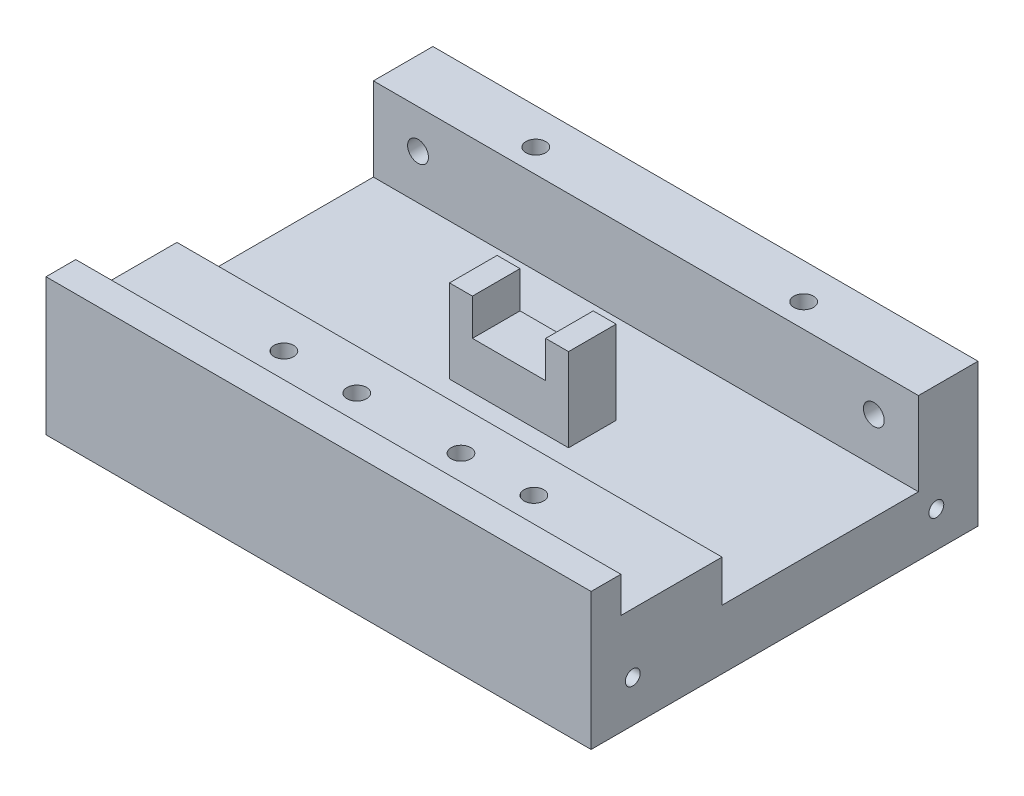
from build123d import *

# Parameters (mm, degrees)
SKETCH1_W                  = 91.58
SKETCH1_H                  = 70.12
SKETCH1_R                  = 1.75
BOSS_EXTRUDE1_DEPTH        = 10
SKETCH2_W                  = 91.58
SKETCH2_H                  = 65
BOSS_EXTRUDE2_DEPTH        = 10
SKETCH3_W                  = 20
SKETCH3_H                  = 8
BOSS_EXTRUDE3_DEPTH        = 14
CUT_EXTRUDE1_DEPTH         = 75
SKETCH6_W                  = 91.58
SKETCH6_H                  = 65
CUT_EXTRUDE3_DEPTH         = 98.319979963
SKETCH11_W                 = 91.58
SKETCH11_H                 = 22
BOSS_EXTRUDE4_DEPTH        = 7
SKETCH12_W                 = 91.58
SKETCH12_H                 = 5
BOSS_EXTRUDE5_DEPTH        = 6
M4_TAPPED_HOLE2_D          = 3.3
M4_TAPPED_HOLE2_DEPTH      = 10
M4_TAPPED_HOLE2_TIP        = 0.991420021
SKETCH16_R                 = 4.25
CUT_EXTRUDE4_DEPTH         = 12
M4_TAPPED_HOLE3_D          = 3.3
SKETCH21_R                 = 3.5
CUT_EXTRUDE5_DEPTH         = 4
M4_TAPPED_HOLE4_D          = 3.3
M4_TAPPED_HOLE4_DEPTH      = 15
M4_TAPPED_HOLE4_TIP        = 0.991420021
M3_TAPPED_HOLE1_AT_2_COUNT = 2
M3_TAPPED_HOLE1_AT_2_PITCH = 51.009802979


with BuildPart() as part:
    # Sketch1 → Boss-Extrude1 (new body)
    with BuildSketch(Plane.XY):
        Rectangle(SKETCH1_W, SKETCH1_H)
        with Locations((-16.825414035, 27.05)):
            Circle(SKETCH1_R, mode=Mode.SUBTRACT)
        with Locations((33.464, 27.56)):
            Circle(SKETCH1_R, mode=Mode.SUBTRACT)
        with Locations((38.29, -27.56)):
            Circle(SKETCH1_R, mode=Mode.SUBTRACT)
        with Locations((-38.29, -27.56)):
            Circle(SKETCH1_R, mode=Mode.SUBTRACT)
    extrude(amount=BOSS_EXTRUDE1_DEPTH)

    # Sketch2 → Boss-Extrude2 (add)
    with BuildSketch(Plane.XZ.offset(35.06)):
        with Locations((0, 32.5)):
            Rectangle(SKETCH2_W, SKETCH2_H)
    extrude(amount=BOSS_EXTRUDE2_DEPTH)

    # Sketch3 → Boss-Extrude3 (add)
    with BuildSketch(Plane(origin=(0, -35.06, 0), x_dir=(1, 0, 0), z_dir=(0, 1, 0))):
        with Locations((0, -29)):
            Rectangle(SKETCH3_W, SKETCH3_H)
    extrude(amount=BOSS_EXTRUDE3_DEPTH)

    # Sketch4 → Cut-Extrude1 (cut)
    with BuildSketch(Plane(origin=(0, 0, 25), x_dir=(-1, 0, 0), z_dir=(0, 0, -1))):
        Polygon((6.15, -21.06), (6.15, -14.91), (-6.15, -14.91), (-6.15, -21.06), (-6.15, -27.21), (6.15, -27.21), align=None)
    extrude(amount=-CUT_EXTRUDE1_DEPTH, mode=Mode.SUBTRACT)

    # Sketch6 → Cut-Extrude3 (cut, through all)
    with BuildSketch(Plane(origin=(0, -21.06, 0), x_dir=(1, 0, 0), z_dir=(0, 1, 0))):
        with Locations((0, -32.5)):
            Rectangle(SKETCH6_W, SKETCH6_H)
    extrude(amount=CUT_EXTRUDE3_DEPTH, mode=Mode.SUBTRACT)

    # Sketch11 → Boss-Extrude4 (add)
    with BuildSketch(Plane(origin=(0, -35.06, 0), x_dir=(1, 0, 0), z_dir=(0, 1, 0))):
        with Locations((0, -54)):
            Rectangle(SKETCH11_W, SKETCH11_H)
    extrude(amount=BOSS_EXTRUDE4_DEPTH)

    # Sketch12 → Boss-Extrude5 (add)
    with BuildSketch(Plane(origin=(0, -28.06, 0), x_dir=(1, 0, 0), z_dir=(0, 1, 0))):
        with Locations((0, -62.5)):
            Rectangle(SKETCH12_W, SKETCH12_H)
    extrude(amount=BOSS_EXTRUDE5_DEPTH)

    # M4 Tapped Hole2
    with Locations(Plane(origin=(0, -28.06, 0), x_dir=(1, 0, 0), z_dir=(0, 1, 0))):
        with Locations((21, -49.825), (-21, -49.825)):
            Hole(M4_TAPPED_HOLE2_D / 2, depth=M4_TAPPED_HOLE2_DEPTH)
            with Locations((0, 0, -(M4_TAPPED_HOLE2_DEPTH + M4_TAPPED_HOLE2_TIP / 2))):  # 118° drill point
                Cone(0, M4_TAPPED_HOLE2_D / 2, M4_TAPPED_HOLE2_TIP, mode=Mode.SUBTRACT)

    # Sketch16 → Cut-Extrude4 (cut)
    with BuildSketch(Plane.XZ.offset(45.06)):
        with Locations(Location((-8.75, 49.825, 0), (0, 0, 270))):
            Circle(SKETCH16_R)
        with Locations(Location((8.75, 49.825, 0), (0, 0, 270))):
            Circle(SKETCH16_R)
    extrude(amount=-CUT_EXTRUDE4_DEPTH, mode=Mode.SUBTRACT)

    # M4 Tapped Hole3 (through all)
    with Locations(Plane(origin=(0, -33.06, 0), x_dir=(-1, 0, 0), z_dir=(0, -1, 0))):
        with Locations((8.75, -49.825), (-8.75, -49.825)):
            Hole(M4_TAPPED_HOLE3_D / 2)

    # Sketch21 → Cut-Extrude5 (cut)
    with BuildSketch(Plane(origin=(0, 0, 0), x_dir=(-1, 0, 0), z_dir=(0, 0, -1))):
        with Locations((-38.29, -27.56)):
            Circle(SKETCH21_R)
        with Locations((38.29, -27.56)):
            Circle(SKETCH21_R)
    extrude(amount=-CUT_EXTRUDE5_DEPTH, mode=Mode.SUBTRACT)

    # M4 Tapped Hole4
    with Locations(Plane(origin=(0, -21.06, 0), x_dir=(1, 0, 0), z_dir=(0, 1, 0))):
        with Locations((-22.5, -6), (22.5, -6)):
            Hole(M4_TAPPED_HOLE4_D / 2, depth=M4_TAPPED_HOLE4_DEPTH)
            with Locations((0, 0, -(M4_TAPPED_HOLE4_DEPTH + M4_TAPPED_HOLE4_TIP / 2))):  # 118° drill point
                Cone(0, M4_TAPPED_HOLE4_D / 2, M4_TAPPED_HOLE4_TIP, mode=Mode.SUBTRACT)

    # Sketch27 → M3 Tapped Hole1 (revolve, cut)
    with BuildSketch(Plane(origin=(-45.79, -38.06, 58), x_dir=(0, 0, 1), z_dir=(0, 1, 0))):
        Polygon((0, 0), (0, 8.251075774), (1.25, 7.5), (1.25, 0), align=None)
    m3_tapped_hole1 = revolve(axis=Axis((-52.14, -38.06, 58), (1, 0, 0)), mode=Mode.SUBTRACT)

    # M3 Tapped Hole1 at 2: M3 Tapped Hole1 ×2
    with Locations(*[Vector(0, -0.0196040749344456, -0.9998078216567245) * (i * M3_TAPPED_HOLE1_AT_2_PITCH) for i in range(1, M3_TAPPED_HOLE1_AT_2_COUNT)]):
        add(m3_tapped_hole1, mode=Mode.SUBTRACT)

    # Mirror1: M3 Tapped Hole1 across plane
    add(m3_tapped_hole1.mirror(Plane(origin=(0, 0, 0), x_dir=(0, 0, 1), z_dir=(1, 0, 0))), mode=Mode.SUBTRACT)

    # Mirror1 copy 1 sketch → Mirror1 copy 1 (revolve, cut)
    with BuildSketch(Plane(origin=(45.79, -39.06, 7), x_dir=(0, 0, 1), z_dir=(0, 1, 0))):
        Polygon((0, 0), (0, -8.251075774), (1.25, -7.5), (1.25, 0), align=None)
    revolve(axis=Axis((52.14, -39.06, 7), (1, 0, 0)), mode=Mode.SUBTRACT)


solid = part.part
